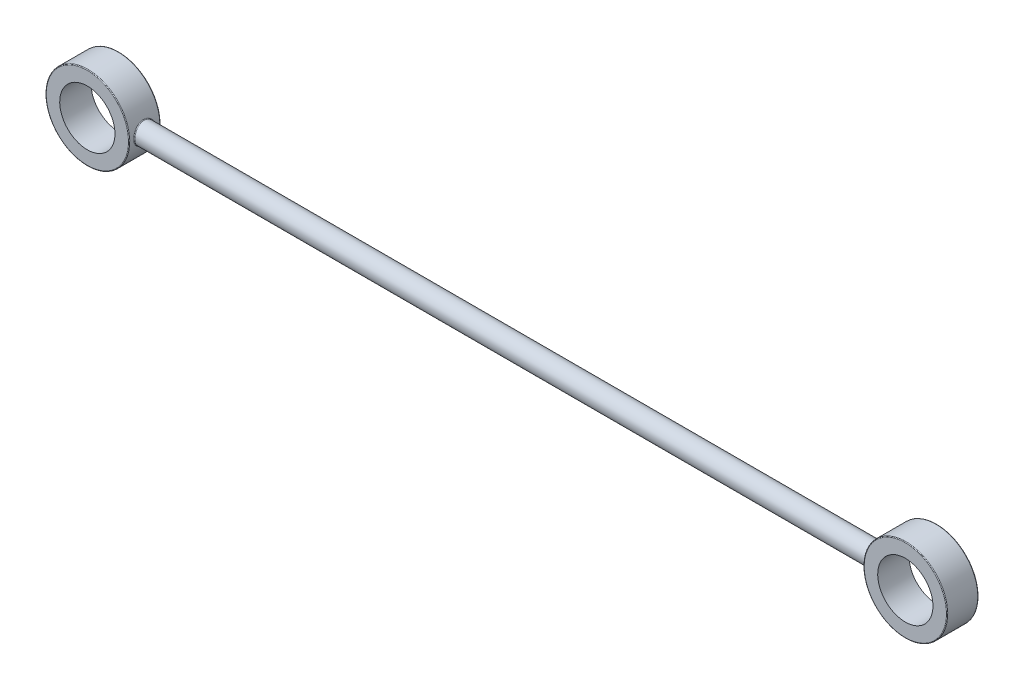
from build123d import *

# Parameters (mm, degrees)
SKETCH1_R                            = 12
SKETCH1_R_2                          = 7.94
BOSS_EXTRUDE1_DEPTH                  = 4.5
BOSS_EXTRUDE1_2_DEPTH                = 4.5
BOSS_EXTRUDE2_REACH                  = 135.457
BOSS_EXTRUDE2_END_RADIUS             = 12
SKETCH3_R                            = 3
BOSS_EXTRUDE2_DIRECTION_2_REACH      = 135.457
BOSS_EXTRUDE2_DIRECTION_2_END_RADIUS = 12
FILLET1_R                            = 0.2
BODY_MOVE_COPY2_ANGLE                = 90


with BuildPart() as part:
    # Sketch1 → Boss-Extrude1 (new, symmetric)
    with BuildSketch(Plane(origin=(0, 0, 0), x_dir=(1, 0, 0), z_dir=(0, 1, 0))):
        with Locations(Location((-114.16, 0, 0), (0, 0, 270))):
            Circle(SKETCH1_R)
        with Locations(Location((-114.16, 0, 0), (0, 0, 270))):
            Circle(SKETCH1_R_2, mode=Mode.SUBTRACT)
    extrude(amount=BOSS_EXTRUDE1_DEPTH, both=True)



with BuildPart() as body_2:
    # Sketch1 → Boss-Extrude1 2 (new, symmetric)
    with BuildSketch(Plane(origin=(0, 0, 0), x_dir=(1, 0, 0), z_dir=(0, 1, 0))):
        with Locations(Location((120.84, 0, 0), (0, 0, 270))):
            Circle(SKETCH1_R)
        with Locations(Location((120.84, 0, 0), (0, 0, 270))):
            Circle(SKETCH1_R_2, mode=Mode.SUBTRACT)
    extrude(amount=BOSS_EXTRUDE1_2_DEPTH, both=True)


with BuildPart() as part_1:
    add(part.part)

    add(body_2.part)  # Boss-Extrude2 merges body 2
    # Boss-Extrude2: up to this cylinder (the profile starts outside it)
    boss_extrude2_end = Plane(origin=(120.84, 0, 0), z_dir=(0, -1, 0)) * Cylinder(BOSS_EXTRUDE2_END_RADIUS, 295.914, mode=Mode.PRIVATE)
    # Sketch3 → Boss-Extrude2 (add, up to the surface)
    with BuildSketch(Plane(origin=(0, 0, 0), x_dir=(0, 0, -1), z_dir=(1, 0, 0)), mode=Mode.PRIVATE) as boss_extrude2_sk1:
        Circle(SKETCH3_R)
    boss_extrude2_tool1 = extrude(boss_extrude2_sk1.sketch, amount=BOSS_EXTRUDE2_REACH, mode=Mode.PRIVATE) - boss_extrude2_end
    add(boss_extrude2_tool1.solids().sort_by_distance((0, 0, 0))[0])

    # Boss-Extrude2 direction 2: up to this cylinder (the profile starts outside it)
    boss_extrude2_direction_2_end = Plane(origin=(-114.16, 0, 0), z_dir=(0, -1, 0)) * Cylinder(BOSS_EXTRUDE2_DIRECTION_2_END_RADIUS, 295.914, mode=Mode.PRIVATE)
    # Sketch3 → Boss-Extrude2 direction 2 (add, up to the surface)
    with BuildSketch(Plane(origin=(0, 0, 0), x_dir=(0, 0, -1), z_dir=(1, 0, 0)), mode=Mode.PRIVATE) as boss_extrude2_direction_2_sk1:
        Circle(SKETCH3_R)
    boss_extrude2_direction_2_tool1 = extrude(boss_extrude2_direction_2_sk1.sketch, amount=-BOSS_EXTRUDE2_DIRECTION_2_REACH, mode=Mode.PRIVATE) - boss_extrude2_direction_2_end
    add(boss_extrude2_direction_2_tool1.solids().sort_by_distance((0, 0, 0))[0])

    # Fillet1
    fillet1_edges = [part_1.edges().sort_by_distance(p)[0] for p in [
        (-102.541049963, 0, 3.000000015),
        (109.221049963, 0, 3.000000015),
        (120.84, 4.5, -12),
        (120.84, -4.5, -12),
        (-114.16, -4.5, -12),
        (-114.16, 4.5, -12),
    ]]
    fillet(fillet1_edges, radius=FILLET1_R)


with BuildPart() as part_2:
    # Body-Move/Copy2: moved
    add(part_1.part.rotate(Axis((0, 0, 0), (0.9999999999964604, 0, -2.660711581397482e-06)), BODY_MOVE_COPY2_ANGLE))


solid = part_2.part
